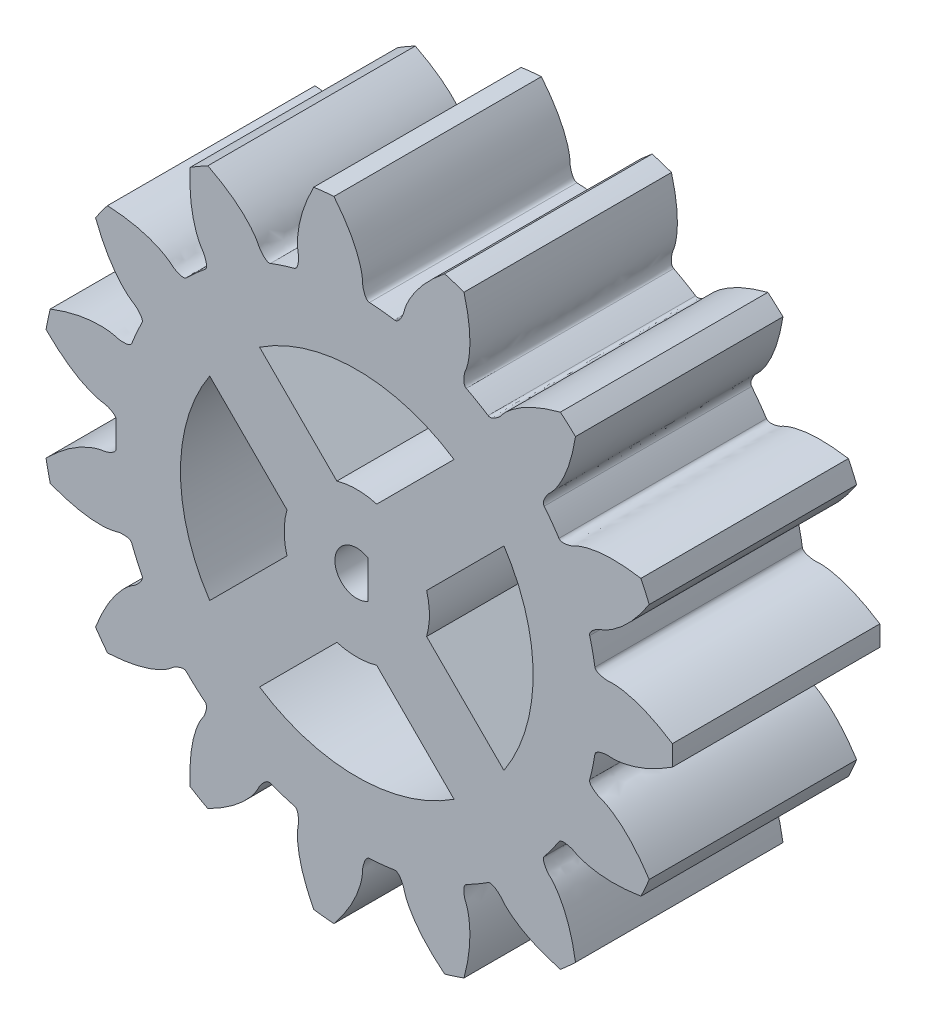
from build123d import *

# Parameters (mm, degrees)
BOSS_EXTRUDE1_DEPTH = 25.4
CIRPATTERN1_COUNT   = 15
SCALE1_SCALE        = 0.5
CUT_EXTRUDE1_DEPTH  = 509.682930984
CUT_EXTRUDE2_DEPTH  = 509.682930984


with BuildPart() as part:
    # Sketch4 → Boss-Extrude1 (new body)
    with BuildSketch(Plane.XY):
        with BuildLine():
            ThreePointArc((481.19390787, 28.509627354), (480.450230569, 28.299888663), (479.712298425, 28.070754642))
            ThreePointArc((479.712298425, 28.070754642), (491.918232432, -29.353650002), (491.918232432, 29.353650002))
            ThreePointArc((491.918232432, 29.353650002), (491.148786235, 29.424352175), (490.37775294, 29.474888367))
            add(Edge.make_bspline(
                [(486.033865095, 38.5504233), (487.371707803, 36.890607467), (488.929067097, 34.516579618), (489.541584699, 31.735385876), (489.547809117, 30.929837928), (489.598011898, 30.662093832), (489.775695257, 30.03285869), (490.027192848, 29.493260443), (490.37775294, 29.474888367)],
                knots=[0, 0, 0, 0, 0.619178971, 0.789288062, 0.81260401, 0.847923511, 0.867104604, 1, 1, 1, 1], degree=3))
            ThreePointArc((486.033865095, 38.5504233), (484.792814245, 38.440175518), (483.555961532, 38.289985141))
            add(Edge.make_bspline(
                [(483.555961532, 38.289985141), (482.592449013, 36.388287126), (481.5627099, 33.742344279), (481.54181997, 30.894576722), (481.703214407, 30.1053378), (481.709775805, 29.83300681), (481.666800596, 29.180579518), (481.532987615, 28.600483498), (481.19390787, 28.509627354)],
                knots=[0, 0, 0, 0, 0.619178971, 0.789288062, 0.81260401, 0.847923511, 0.867104604, 1, 1, 1, 1], degree=3))
        make_face()
    boss_extrude1 = extrude(amount=BOSS_EXTRUDE1_DEPTH)

    # CirPattern1: Boss-Extrude1 ×15 about axis
    cirpattern1_axis = Axis((488.833039497, 0, 25.4), (0, 0, -1))
    for i in range(1, CIRPATTERN1_COUNT):
        add(boss_extrude1.rotate(cirpattern1_axis, i * 360 / CIRPATTERN1_COUNT))


with BuildPart() as part_1:
    # Scale1: scaled about (488.832910167, 0, 12.7)
    add(part.part.scale(SCALE1_SCALE).moved(Location((244.416455084, 0, 6.35))))

    # Sketch6 → Cut-Extrude1 (cut, through all)
    with BuildSketch(Plane.XY.offset(19.05)):
        with BuildLine():
            Line((489.523039497, 1.148694912), (489.523039497, -1.148694912))
            ThreePointArc((489.523039497, -1.148694912), (487.493039497, 0), (489.523039497, 1.148694912))
        make_face()
    extrude(amount=-CUT_EXTRUDE1_DEPTH, mode=Mode.SUBTRACT)

    # Sketch7 → Cut-Extrude2 (cut, through all)
    with BuildSketch(Plane.XY.offset(19.05)):
        with BuildLine():
            Line((482.88068765, 9.005638928), (487.612252965, 4.274073612))
            ThreePointArc((487.612252965, 4.274073612), (488.833039497, 4.445), (490.053826028, 4.274073612))
            Line((490.053826028, 4.274073612), (494.785391343, 9.005638928))
            ThreePointArc((494.785391343, 9.005638928), (488.833039497, 10.795), (482.88068765, 9.005638928))
        make_face()
        with BuildLine():
            Line((493.107113109, 1.220786531), (497.838678424, 5.952351847))
            ThreePointArc((497.838678424, 5.952351847), (499.628039497, 0), (497.838678424, -5.952351847))
            Line((497.838678424, -5.952351847), (493.107113109, -1.220786531))
            ThreePointArc((493.107113109, -1.220786531), (493.278039497, 0), (493.107113109, 1.220786531))
        make_face()
        with BuildLine():
            Line((490.053826028, -4.274073612), (494.785391343, -9.005638928))
            ThreePointArc((494.785391343, -9.005638928), (488.833039497, -10.795), (482.88068765, -9.005638928))
            Line((482.88068765, -9.005638928), (487.612252965, -4.274073612))
            ThreePointArc((487.612252965, -4.274073612), (488.833039497, -4.445), (490.053826028, -4.274073612))
        make_face()
        with BuildLine():
            Line((484.558965884, -1.220786531), (479.827400569, -5.952351847))
            ThreePointArc((479.827400569, -5.952351847), (478.038039497, 0), (479.827400569, 5.952351847))
            Line((479.827400569, 5.952351847), (484.558965884, 1.220786531))
            ThreePointArc((484.558965884, 1.220786531), (484.388039497, 0), (484.558965884, -1.220786531))
        make_face()
    extrude(amount=-CUT_EXTRUDE2_DEPTH, mode=Mode.SUBTRACT)


solid = part_1.part
